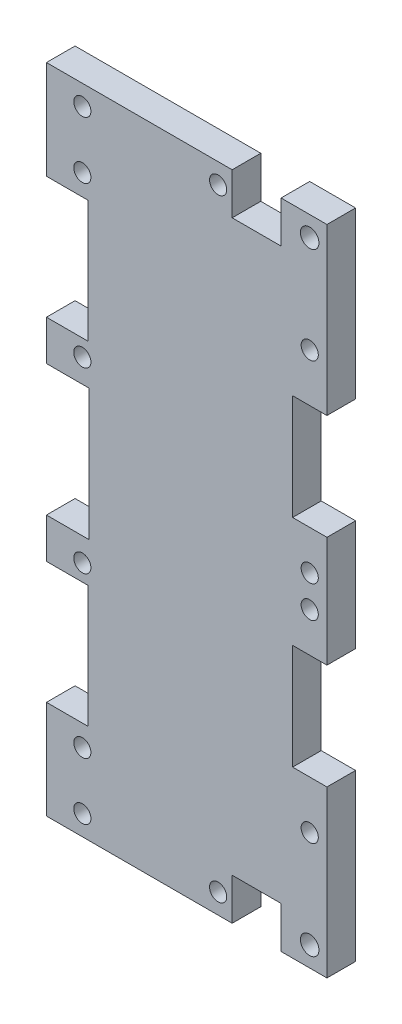
from build123d import *

# Parameters (mm, degrees)
EXTRUDE_1_DEPTH     = 10
SKETCH_2_R          = 1.5
CUT_EXTRUDE_1_DEPTH = 10
SKETCH_3_R          = 1.5
CUT_EXTRUDE_2_DEPTH = 10
SKETCH_5_W          = 49.01
SKETCH_5_H          = 114.02
EXTRUDE_2_DEPTH     = 5
SKETCH_7_W          = 7.579952265
SKETCH_7_H          = 21.325107759
SKETCH_7_H_2        = 11.778124307
SKETCH_7_W_2        = 8.542902392
SKETCH_7_H_3        = 7.419730403
CUT_EXTRUDE_3_DEPTH = 10
SKETCH_8_W          = 6
SKETCH_8_H          = 18.426440066
CUT_EXTRUDE_4_DEPTH = 10
SKETCH_9_R          = 1.5
SKETCH_9_R_2        = 1.621792445
CUT_EXTRUDE_5_DEPTH = 10


with BuildPart() as part:
    # 草图1 → 凸台-拉伸1 (new body)
    with BuildSketch(Plane.XY):
        with BuildLine():
            Line((118, 210), (-118, 210))
            Line((-118, 210), (-118, -210))
            Line((-118, -210), (118, -210))
            Line((118, -210), (118, -50.5))
            Line((118, -50.5), (54.15, -50.5))
            Line((54.15, -50.5), (54.15, -9.334147293))
            ThreePointArc((54.15, -9.334147293), (42.020728949, 0), (54.15, 9.334147293))
            Line((54.15, 9.334147293), (54.15, 50.5))
            Line((54.15, 50.5), (118, 50.5))
            Line((118, 50.5), (118, 210))
        make_face()
    extrude(amount=EXTRUDE_1_DEPTH)

    # 草图2 → 切除-拉伸1 (cut)
    with BuildSketch(Plane.XY.offset(10)):
        with Locations((-88, 135)):
            Circle(SKETCH_2_R)
        with Locations((-43, 180)):
            Circle(SKETCH_2_R)
        with Locations((-88, 180)):
            Circle(SKETCH_2_R)
    extrude(amount=-CUT_EXTRUDE_1_DEPTH, mode=Mode.SUBTRACT)

    # 草图3 → 切除-拉伸2 (cut)
    with BuildSketch(Plane.XY.offset(10)):
        with Locations((51.15, -15.672792958)):
            Circle(SKETCH_3_R)
        with Locations((112.73, -53.5)):
            Circle(SKETCH_3_R)
        with Locations((112.73, -59.5)):
            Circle(SKETCH_3_R)
        with Locations((87.23, -53.5)):
            Circle(SKETCH_3_R)
        with Locations((87.23, -59.5)):
            Circle(SKETCH_3_R)
        with Locations((77.23, -53.5)):
            Circle(SKETCH_3_R)
        with Locations((61.23, -53.5)):
            Circle(SKETCH_3_R)
        with Locations((51.15, -53.5)):
            Circle(SKETCH_3_R)
        with Locations((51.15, -43.5)):
            Circle(SKETCH_3_R)
    cut_extrude_2 = extrude(amount=-CUT_EXTRUDE_2_DEPTH, mode=Mode.SUBTRACT)

    # 镜向1: 切除-拉伸2 across plane
    add(cut_extrude_2.mirror(Plane.ZX), mode=Mode.SUBTRACT)


with BuildPart() as body_2:
    # 草图5 → 凸台-拉伸2 (new body)
    with BuildSketch(Plane.XY.offset(20)):
        with Locations((57.393575669, 0)):
            Rectangle(SKETCH_5_W, SKETCH_5_H)
    extrude(amount=EXTRUDE_2_DEPTH)

    # 草图7 → 切除-拉伸3 (cut)
    with BuildSketch(Plane.XY.offset(25)):
        with Locations((36.372677837, 29.137446121)):
            Rectangle(SKETCH_7_W, SKETCH_7_H)
        with Locations((36.502822244, 5.570937847)):
            Rectangle(SKETCH_7_W, SKETCH_7_H_2)
        with Locations((69.609392324, 53.445086976)):
            Rectangle(SKETCH_7_W_2, SKETCH_7_H_3)
    cut_extrude_3 = extrude(amount=-CUT_EXTRUDE_3_DEPTH, mode=Mode.SUBTRACT)

    # 镜向2: 切除-拉伸3 across plane
    add(cut_extrude_3.mirror(Plane.ZX), mode=Mode.SUBTRACT)

    # 草图8 → 切除-拉伸4 (cut)
    with BuildSketch(Plane.XY.offset(25)):
        with Locations((78.898575669, 18.887565602)):
            Rectangle(SKETCH_8_W, SKETCH_8_H)
    cut_extrude_4 = extrude(amount=-CUT_EXTRUDE_4_DEPTH, mode=Mode.SUBTRACT)

    # 镜向3: 切除-拉伸4 across plane
    add(cut_extrude_4.mirror(Plane.ZX), mode=Mode.SUBTRACT)

    # 草图9 → 切除-拉伸5 (cut)
    with BuildSketch(Plane.XY.offset(25)):
        with Locations((39.158575669, 53.5)):
            Circle(SKETCH_9_R)
        with Locations((62.888575669, 53.5)):
            Circle(SKETCH_9_R)
        with Locations((39.158575669, 43.5)):
            Circle(SKETCH_9_R)
        with Locations((78.88084352, 53.5)):
            Circle(SKETCH_9_R_2)
        with Locations((39.158575669, 15.564892241)):
            Circle(SKETCH_9_R)
        with Locations((78.888575669, 36.510785635)):
            Circle(SKETCH_9_R)
        with Locations((78.888575669, 2.775221774)):
            Circle(SKETCH_9_R)
    cut_extrude_5 = extrude(amount=-CUT_EXTRUDE_5_DEPTH, mode=Mode.SUBTRACT)

    # 镜向5: 切除-拉伸5 across plane
    add(cut_extrude_5.mirror(Plane.ZX), mode=Mode.SUBTRACT)


solid = body_2.part
